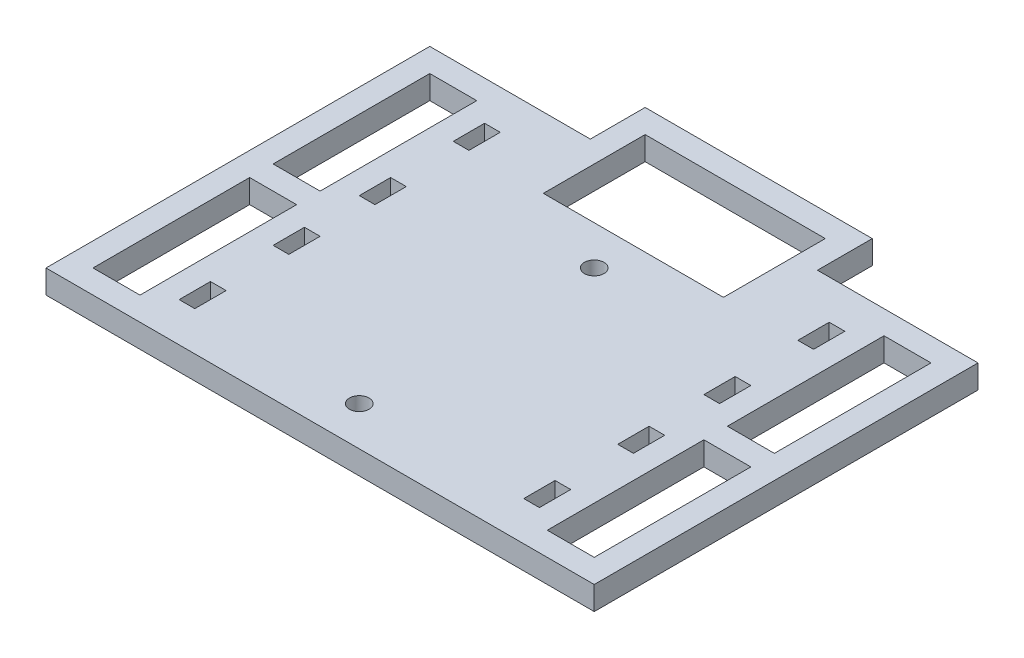
from build123d import *

# Parameters (mm, degrees)
SKETCH_1_W          = 70
SKETCH_1_H          = 56
EXTRUDE_1_DEPTH     = 3
CUT_EXTRUDE_1_REACH = 46.922
SKETCH_2_R          = 1.25
SKETCH_2_W          = 23
SKETCH_2_H          = 13
SKETCH_2_W_2        = 6
SKETCH_2_H_2        = 20
SKETCH_2_W_3        = 2
SKETCH_2_H_3        = 4
SKETCH_2_W_4        = 20.5
SKETCH_2_H_4        = 7


with BuildPart() as part:
    # 草图1 → 凸台-拉伸1 (new body)
    with BuildSketch(Plane(origin=(0, 0, 0), x_dir=(1, 0, 0), z_dir=(0, 1, 0))):
        Rectangle(SKETCH_1_W, SKETCH_1_H)
    extrude(amount=EXTRUDE_1_DEPTH)

    # 草图2 → 切除-拉伸1 (cut, up to next)
    with BuildSketch(Plane(origin=(0, 3, 0), x_dir=(1, 0, 0), z_dir=(0, 1, 0)), mode=Mode.PRIVATE) as cut_extrude_1_sk1:
        with Locations(Location((0, 7, 0), (0, 0, 270))):
            Circle(SKETCH_2_R)
    cut_extrude_1_tool1 = extrude(cut_extrude_1_sk1.sketch, amount=-CUT_EXTRUDE_1_REACH, mode=Mode.PRIVATE) & part.part
    # 草图2 → 切除-拉伸1 (cut, up to next)
    with BuildSketch(Plane(origin=(0, 3, 0), x_dir=(1, 0, 0), z_dir=(0, 1, 0)), mode=Mode.PRIVATE) as cut_extrude_1_sk2:
        with Locations(Location((0, -23, 0), (0, 0, 270))):
            Circle(SKETCH_2_R)
    cut_extrude_1_tool2 = extrude(cut_extrude_1_sk2.sketch, amount=-CUT_EXTRUDE_1_REACH, mode=Mode.PRIVATE) & part.part
    # 草图2 → 切除-拉伸1 (cut, up to next)
    with BuildSketch(Plane(origin=(0, 3, 0), x_dir=(1, 0, 0), z_dir=(0, 1, 0)), mode=Mode.PRIVATE) as cut_extrude_1_sk3:
        with Locations((0, 18.5)):
            Rectangle(SKETCH_2_W, SKETCH_2_H)
    cut_extrude_1_tool3 = extrude(cut_extrude_1_sk3.sketch, amount=-CUT_EXTRUDE_1_REACH, mode=Mode.PRIVATE) & part.part
    # 草图2 → 切除-拉伸1 (cut, up to next)
    with BuildSketch(Plane(origin=(0, 3, 0), x_dir=(1, 0, 0), z_dir=(0, 1, 0)), mode=Mode.PRIVATE) as cut_extrude_1_sk4:
        with Locations((-29, -15)):
            Rectangle(SKETCH_2_W_2, SKETCH_2_H_2)
    cut_extrude_1_tool4 = extrude(cut_extrude_1_sk4.sketch, amount=-CUT_EXTRUDE_1_REACH, mode=Mode.PRIVATE) & part.part
    # 草图2 → 切除-拉伸1 (cut, up to next)
    with BuildSketch(Plane(origin=(0, 3, 0), x_dir=(1, 0, 0), z_dir=(0, 1, 0)), mode=Mode.PRIVATE) as cut_extrude_1_sk5:
        with Locations((-29, 8)):
            Rectangle(SKETCH_2_W_2, SKETCH_2_H_2)
    cut_extrude_1_tool5 = extrude(cut_extrude_1_sk5.sketch, amount=-CUT_EXTRUDE_1_REACH, mode=Mode.PRIVATE) & part.part
    # 草图2 → 切除-拉伸1 (cut, up to next)
    with BuildSketch(Plane(origin=(0, 3, 0), x_dir=(1, 0, 0), z_dir=(0, 1, 0)), mode=Mode.PRIVATE) as cut_extrude_1_sk6:
        with Locations((29, -15)):
            Rectangle(SKETCH_2_W_2, SKETCH_2_H_2)
    cut_extrude_1_tool6 = extrude(cut_extrude_1_sk6.sketch, amount=-CUT_EXTRUDE_1_REACH, mode=Mode.PRIVATE) & part.part
    # 草图2 → 切除-拉伸1 (cut, up to next)
    with BuildSketch(Plane(origin=(0, 3, 0), x_dir=(1, 0, 0), z_dir=(0, 1, 0)), mode=Mode.PRIVATE) as cut_extrude_1_sk7:
        with Locations((29, 8)):
            Rectangle(SKETCH_2_W_2, SKETCH_2_H_2)
    cut_extrude_1_tool7 = extrude(cut_extrude_1_sk7.sketch, amount=-CUT_EXTRUDE_1_REACH, mode=Mode.PRIVATE) & part.part
    # 草图2 → 切除-拉伸1 (cut, up to next)
    with BuildSketch(Plane(origin=(0, 3, 0), x_dir=(1, 0, 0), z_dir=(0, 1, 0)), mode=Mode.PRIVATE) as cut_extrude_1_sk8:
        with Locations((-22, 2)):
            Rectangle(SKETCH_2_W_3, SKETCH_2_H_3)
    cut_extrude_1_tool8 = extrude(cut_extrude_1_sk8.sketch, amount=-CUT_EXTRUDE_1_REACH, mode=Mode.PRIVATE) & part.part
    # 草图2 → 切除-拉伸1 (cut, up to next)
    with BuildSketch(Plane(origin=(0, 3, 0), x_dir=(1, 0, 0), z_dir=(0, 1, 0)), mode=Mode.PRIVATE) as cut_extrude_1_sk9:
        with Locations((-22, 14)):
            Rectangle(SKETCH_2_W_3, SKETCH_2_H_3)
    cut_extrude_1_tool9 = extrude(cut_extrude_1_sk9.sketch, amount=-CUT_EXTRUDE_1_REACH, mode=Mode.PRIVATE) & part.part
    # 草图2 → 切除-拉伸1 (cut, up to next)
    with BuildSketch(Plane(origin=(0, 3, 0), x_dir=(1, 0, 0), z_dir=(0, 1, 0)), mode=Mode.PRIVATE) as cut_extrude_1_sk10:
        with Locations((22, 2)):
            Rectangle(SKETCH_2_W_3, SKETCH_2_H_3)
    cut_extrude_1_tool10 = extrude(cut_extrude_1_sk10.sketch, amount=-CUT_EXTRUDE_1_REACH, mode=Mode.PRIVATE) & part.part
    # 草图2 → 切除-拉伸1 (cut, up to next)
    with BuildSketch(Plane(origin=(0, 3, 0), x_dir=(1, 0, 0), z_dir=(0, 1, 0)), mode=Mode.PRIVATE) as cut_extrude_1_sk11:
        with Locations((22, 14)):
            Rectangle(SKETCH_2_W_3, SKETCH_2_H_3)
    cut_extrude_1_tool11 = extrude(cut_extrude_1_sk11.sketch, amount=-CUT_EXTRUDE_1_REACH, mode=Mode.PRIVATE) & part.part
    # 草图2 → 切除-拉伸1 (cut, up to next)
    with BuildSketch(Plane(origin=(0, 3, 0), x_dir=(1, 0, 0), z_dir=(0, 1, 0)), mode=Mode.PRIVATE) as cut_extrude_1_sk12:
        with Locations((24.75, 24.5)):
            Rectangle(SKETCH_2_W_4, SKETCH_2_H_4)
    cut_extrude_1_tool12 = extrude(cut_extrude_1_sk12.sketch, amount=-CUT_EXTRUDE_1_REACH, mode=Mode.PRIVATE) & part.part
    # 草图2 → 切除-拉伸1 (cut, up to next)
    with BuildSketch(Plane(origin=(0, 3, 0), x_dir=(1, 0, 0), z_dir=(0, 1, 0)), mode=Mode.PRIVATE) as cut_extrude_1_sk13:
        with Locations((-24.75, 24.5)):
            Rectangle(SKETCH_2_W_4, SKETCH_2_H_4)
    cut_extrude_1_tool13 = extrude(cut_extrude_1_sk13.sketch, amount=-CUT_EXTRUDE_1_REACH, mode=Mode.PRIVATE) & part.part
    # 草图2 → 切除-拉伸1 (cut, up to next)
    with BuildSketch(Plane(origin=(0, 3, 0), x_dir=(1, 0, 0), z_dir=(0, 1, 0)), mode=Mode.PRIVATE) as cut_extrude_1_sk14:
        with Locations((-22, -9)):
            Rectangle(SKETCH_2_W_3, SKETCH_2_H_3)
    cut_extrude_1_tool14 = extrude(cut_extrude_1_sk14.sketch, amount=-CUT_EXTRUDE_1_REACH, mode=Mode.PRIVATE) & part.part
    # 草图2 → 切除-拉伸1 (cut, up to next)
    with BuildSketch(Plane(origin=(0, 3, 0), x_dir=(1, 0, 0), z_dir=(0, 1, 0)), mode=Mode.PRIVATE) as cut_extrude_1_sk15:
        with Locations((-22, -21)):
            Rectangle(SKETCH_2_W_3, SKETCH_2_H_3)
    cut_extrude_1_tool15 = extrude(cut_extrude_1_sk15.sketch, amount=-CUT_EXTRUDE_1_REACH, mode=Mode.PRIVATE) & part.part
    # 草图2 → 切除-拉伸1 (cut, up to next)
    with BuildSketch(Plane(origin=(0, 3, 0), x_dir=(1, 0, 0), z_dir=(0, 1, 0)), mode=Mode.PRIVATE) as cut_extrude_1_sk16:
        with Locations((22, -21)):
            Rectangle(SKETCH_2_W_3, SKETCH_2_H_3)
    cut_extrude_1_tool16 = extrude(cut_extrude_1_sk16.sketch, amount=-CUT_EXTRUDE_1_REACH, mode=Mode.PRIVATE) & part.part
    # 草图2 → 切除-拉伸1 (cut, up to next)
    with BuildSketch(Plane(origin=(0, 3, 0), x_dir=(1, 0, 0), z_dir=(0, 1, 0)), mode=Mode.PRIVATE) as cut_extrude_1_sk17:
        with Locations((22, -9)):
            Rectangle(SKETCH_2_W_3, SKETCH_2_H_3)
    cut_extrude_1_tool17 = extrude(cut_extrude_1_sk17.sketch, amount=-CUT_EXTRUDE_1_REACH, mode=Mode.PRIVATE) & part.part
    add(cut_extrude_1_tool1.solids().sort_by_distance((0, 3, -7))[0], mode=Mode.SUBTRACT)
    add(cut_extrude_1_tool2.solids().sort_by_distance((0, 3, 23))[0], mode=Mode.SUBTRACT)
    add(cut_extrude_1_tool3.solids().sort_by_distance((0, 3, -18.5))[0], mode=Mode.SUBTRACT)
    add(cut_extrude_1_tool4.solids().sort_by_distance((-29, 3, 15))[0], mode=Mode.SUBTRACT)
    add(cut_extrude_1_tool5.solids().sort_by_distance((-29, 3, -8))[0], mode=Mode.SUBTRACT)
    add(cut_extrude_1_tool6.solids().sort_by_distance((29, 3, 15))[0], mode=Mode.SUBTRACT)
    add(cut_extrude_1_tool7.solids().sort_by_distance((29, 3, -8))[0], mode=Mode.SUBTRACT)
    add(cut_extrude_1_tool8.solids().sort_by_distance((-22, 3, -2))[0], mode=Mode.SUBTRACT)
    add(cut_extrude_1_tool9.solids().sort_by_distance((-22, 3, -14))[0], mode=Mode.SUBTRACT)
    add(cut_extrude_1_tool10.solids().sort_by_distance((22, 3, -2))[0], mode=Mode.SUBTRACT)
    add(cut_extrude_1_tool11.solids().sort_by_distance((22, 3, -14))[0], mode=Mode.SUBTRACT)
    add(cut_extrude_1_tool12.solids().sort_by_distance((24.75, 3, -24.5))[0], mode=Mode.SUBTRACT)
    add(cut_extrude_1_tool13.solids().sort_by_distance((-24.75, 3, -24.5))[0], mode=Mode.SUBTRACT)
    add(cut_extrude_1_tool14.solids().sort_by_distance((-22, 3, 9))[0], mode=Mode.SUBTRACT)
    add(cut_extrude_1_tool15.solids().sort_by_distance((-22, 3, 21))[0], mode=Mode.SUBTRACT)
    add(cut_extrude_1_tool16.solids().sort_by_distance((22, 3, 21))[0], mode=Mode.SUBTRACT)
    add(cut_extrude_1_tool17.solids().sort_by_distance((22, 3, 9))[0], mode=Mode.SUBTRACT)


solid = part.part
